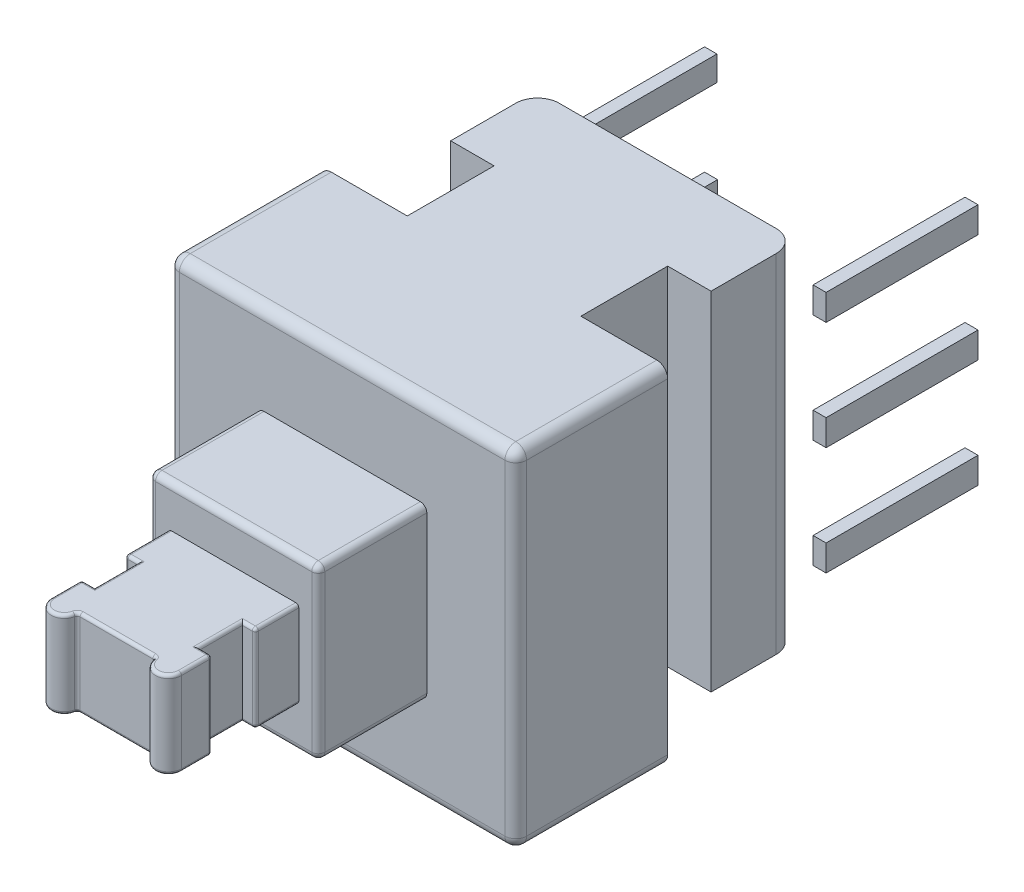
from build123d import *

# Parameters (mm, degrees)
SKETCH_1_W          = 8
SKETCH_1_H          = 8
EXTRUDE_1_DEPTH     = 8
SKETCH_3_W          = 3.9
SKETCH_3_H          = 3.9
EXTRUDE_2_DEPTH     = 2.5
SKETCH_4_W          = 3
SKETCH_4_H          = 2
EXTRUDE_3_DEPTH     = 3
SKETCH_5_W          = 0.3
SKETCH_5_H          = 0.6
SKETCH_5_W_2        = 0.285271027
SKETCH_5_H_2        = 0.570542054
EXTRUDE_4_DEPTH     = 3.5
SKETCH_6_W          = 0.3
SKETCH_6_H          = 1
CUT_EXTRUDE_1_DEPTH = 2
CUT_EXTRUDE_3_DEPTH = 2
FILLET_1_R          = 0.25
FILLET_2_R          = 0.15
FILLET_3_R          = 0.07
CUT_EXTRUDE_5_DEPTH = 17.194134824


with BuildPart() as part:
    # 草圖1 → 填料-伸長1 (new body)
    with BuildSketch(Plane.XY):
        Rectangle(SKETCH_1_W, SKETCH_1_H)
    extrude(amount=EXTRUDE_1_DEPTH)

    # 草圖3 → 填料-伸長2 (add)
    with BuildSketch(Plane.XY.offset(8)):
        Rectangle(SKETCH_3_W, SKETCH_3_H)
    extrude(amount=EXTRUDE_2_DEPTH)

    # 草圖4 → 填料-伸長3 (add)
    with BuildSketch(Plane.XY.offset(10.5)):
        Rectangle(SKETCH_4_W, SKETCH_4_H)
    extrude(amount=EXTRUDE_3_DEPTH)

    # 草圖5 → 填料-伸長4 (add)
    with BuildSketch(Plane(origin=(0, 0, 0), x_dir=(-1, 0, 0), z_dir=(0, 0, -1))):
        with Locations((-3, 0)):
            Rectangle(SKETCH_5_W, SKETCH_5_H)
        with Locations((-3, 2.5)):
            Rectangle(SKETCH_5_W, SKETCH_5_H)
        with Locations((-3, -2.5)):
            Rectangle(SKETCH_5_W, SKETCH_5_H)
        with Locations((3, -2.5)):
            Rectangle(SKETCH_5_W, SKETCH_5_H)
        with Locations((3, 0)):
            Rectangle(SKETCH_5_W, SKETCH_5_H)
        with Locations((3.007364487, 2.514728973)):
            Rectangle(SKETCH_5_W_2, SKETCH_5_H_2)
    extrude(amount=EXTRUDE_4_DEPTH)

    # 草圖6 → 除料-伸長1 (cut)
    with BuildSketch(Plane.XZ.offset(1)):
        with Locations((-1.35, 12)):
            Rectangle(SKETCH_6_W, SKETCH_6_H)
        with Locations((1.35, 12)):
            Rectangle(SKETCH_6_W, SKETCH_6_H)
    extrude(amount=-CUT_EXTRUDE_1_DEPTH, mode=Mode.SUBTRACT)

    # 草圖7 → 除料-伸長3 (cut)
    with BuildSketch(Plane.XZ.offset(1)):
        with BuildLine():
            ThreePointArc((-1.5, 13.2), (-1.412132034, 13.412132034), (-1.2, 13.5))
            Line((-1.2, 13.5), (-1.5, 13.5))
            Line((-1.5, 13.5), (-1.5, 13.2))
        make_face()
        with BuildLine():
            Line((-0.9, 13.2), (0, 13.2))
            Line((0, 13.2), (0.9, 13.2))
            ThreePointArc((0.9, 13.2), (0.987867966, 13.412132034), (1.2, 13.5))
            Line((1.2, 13.5), (0, 13.5))
            Line((0, 13.5), (-1.2, 13.5))
            ThreePointArc((-1.2, 13.5), (-0.987867966, 13.412132034), (-0.9, 13.2))
        make_face()
        with BuildLine():
            Line((1.5, 13.5), (1.2, 13.5))
            ThreePointArc((1.2, 13.5), (1.412132034, 13.412132034), (1.5, 13.2))
            Line((1.5, 13.2), (1.5, 13.5))
        make_face()
    extrude(amount=-CUT_EXTRUDE_3_DEPTH, mode=Mode.SUBTRACT)

    # 圓角1
    fillet_1_edges = [part.edges().sort_by_distance(p)[0] for p in [
        (-4, 0, 8),
        (0, -4, 8),
        (4, 0, 8),
        (0, -4, 0),
        (-4, 0, 0),
        (0, 4, 0),
        (4, 0, 0),
        (0, 4, 8),
        (4, -4, 4),
        (-4, -4, 4),
        (-4, 4, 4),
        (4, 4, 4),
    ]]
    fillet(fillet_1_edges, radius=FILLET_1_R)

    # 圓角2
    fillet_2_edges = [part.edges().sort_by_distance(p)[0] for p in [
        (1.95, -1.95, 9.25),
        (1.95, 1.95, 9.25),
        (-1.95, 1.95, 9.25),
        (-1.95, -1.95, 9.25),
        (1.95, 0, 10.5),
        (0, 1.95, 10.5),
        (-1.95, 0, 10.5),
        (0, -1.95, 10.5),
    ]]
    fillet(fillet_2_edges, radius=FILLET_2_R)

    # 圓角3
    fillet_3_edges = [part.edges().sort_by_distance(p)[0] for p in [
        (1.5, -1, 11),
        (1.5, 1, 11),
        (1.5, 0, 12.5),
        (1.5, 0, 11.5),
        (1.35, -1, 12.5),
        (1.2, -1, 12),
        (1.35, -1, 11.5),
        (1.35, 1, 12.5),
        (1.35, 1, 11.5),
        (1.2, 1, 12),
        (-1.5, -1, 11),
        (-1.5, 1, 11),
        (-1.5, 0, 12.5),
        (-1.5, 0, 11.5),
        (-1.35, -1, 12.5),
        (-1.35, -1, 11.5),
        (-1.2, -1, 12),
        (-1.35, 1, 12.5),
        (-1.2, 1, 12),
        (-1.35, 1, 11.5),
        (-1.5, -1, 12.85),
        (-1.5, 1, 12.85),
        (-1.2, -1, 13.5),
        (-1.2, 1, 13.5),
        (1.2, 1, 13.5),
        (1.2, -1, 13.5),
        (0, 1, 13.2),
        (0.9, 0, 13.2),
        (0, -1, 13.2),
        (-0.9, 0, 13.2),
        (1.5, -1, 12.85),
        (1.5, 1, 12.85),
    ]]
    fillet(fillet_3_edges, radius=FILLET_3_R)

    # 草圖9 → 除料-伸長5 (cut, through all)
    with BuildSketch(Plane.XZ.offset(4)):
        with BuildLine():
            Line((-4, 0), (-4, 4.5))
            Line((-4, 4.5), (-2, 4.5))
            Line((-2, 4.5), (-2, 2.5))
            Line((-2, 2.5), (-3, 2.5))
            Line((-3, 2.5), (-3, 1))
            ThreePointArc((-3, 1), (-2.853553391, 0.646446609), (-2.5, 0.5))
            Line((-2.5, 0.5), (2.5, 0.5))
            ThreePointArc((2.5, 0.5), (2.853553391, 0.646446609), (3, 1))
            Line((3, 1), (3, 2.5))
            Line((3, 2.5), (2, 2.5))
            Line((2, 2.5), (2, 4.5))
            Line((2, 4.5), (4, 4.5))
            Line((4, 4.5), (4, 0))
            Line((4, 0), (-4, 0))
        make_face()
    extrude(amount=-CUT_EXTRUDE_5_DEPTH, mode=Mode.SUBTRACT)


with BuildPart() as cut_extrude_5_piece_1:
    # of the separate pieces the step leaves, piece 1, a body of its own (cut_extrude_5_pieces)
    add(part.part.solids().sort_by_distance((-1.5, -0.93, 10.5))[0])


with BuildPart() as cut_extrude_5_piece_2:
    # of the separate pieces the step leaves, piece 2, a body of its own (cut_extrude_5_pieces)
    add(part.part.solids().sort_by_distance((3.15, 0.3, 0))[0])


with BuildPart() as cut_extrude_5_piece_3:
    # of the separate pieces the step leaves, piece 3, a body of its own (cut_extrude_5_pieces)
    add(part.part.solids().sort_by_distance((-2.85, 0.3, 0))[0])


with BuildPart() as cut_extrude_5_piece_4:
    # of the separate pieces the step leaves, piece 4, a body of its own (cut_extrude_5_pieces)
    add(part.part.solids().sort_by_distance((-2.85, -2.2, 0))[0])


with BuildPart() as cut_extrude_5_piece_5:
    # of the separate pieces the step leaves, piece 5, a body of its own (cut_extrude_5_pieces)
    add(part.part.solids().sort_by_distance((3.15, -2.2, 0))[0])


with BuildPart() as cut_extrude_5_piece_6:
    # of the separate pieces the step leaves, piece 6, a body of its own (cut_extrude_5_pieces)
    add(part.part.solids().sort_by_distance((3.15, 2.8, 0))[0])


with BuildPart() as cut_extrude_5_piece_7:
    # of the separate pieces the step leaves, piece 7, a body of its own (cut_extrude_5_pieces)
    add(part.part.solids().sort_by_distance((-2.864728973, 2.8, 0))[0])


solid = Compound([cut_extrude_5_piece_1.part, cut_extrude_5_piece_2.part, cut_extrude_5_piece_3.part, cut_extrude_5_piece_4.part, cut_extrude_5_piece_5.part, cut_extrude_5_piece_6.part, cut_extrude_5_piece_7.part])
